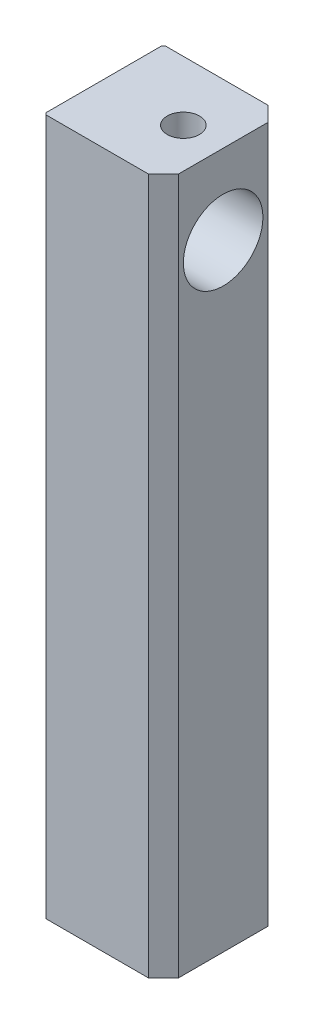
from build123d import *

# Parameters (mm, degrees)
SKETCH1_W           = 12
SKETCH1_H           = 12
BOSS_EXTRUDE1_DEPTH = 70
CHAMFER1_SIZE       = 0.2
CHAMFER2_SIZE       = 1.5
SKETCH2_R           = 4
CUT_EXTRUDE1_DEPTH  = 72.274118725
TAP1_REACH          = 73.274
TAP1_BORE_R         = 1.621


with BuildPart() as part:
    # Sketch1 → Boss-Extrude1 (new body)
    with BuildSketch(Plane(origin=(0, 0, 0), x_dir=(1, 0, 0), z_dir=(0, 1, 0))):
        with Locations((6, 0)):
            Rectangle(SKETCH1_W, SKETCH1_H)
    extrude(amount=BOSS_EXTRUDE1_DEPTH)

    # Chamfer1
    chamfer1_edges = [part.edges().sort_by_distance(p)[0] for p in [
        (0, 35, 6),
        (0, 35, -6),
    ]]
    chamfer(chamfer1_edges, length=CHAMFER1_SIZE)

    # Chamfer2
    chamfer2_edges = [part.edges().sort_by_distance(p)[0] for p in [
        (12, 35, -6),
        (12, 35, 6),
    ]]
    chamfer(chamfer2_edges, length=CHAMFER2_SIZE)

    # Sketch2 → Cut-Extrude1 (cut, through all)
    with BuildSketch(Plane(origin=(0, 0, 0), x_dir=(0, 0, -1), z_dir=(1, 0, 0))):
        with Locations(Location((0, 62, 0), (0, 0, 180))):
            Circle(SKETCH2_R)
    extrude(amount=CUT_EXTRUDE1_DEPTH, mode=Mode.SUBTRACT)

    # Tap1 bore → Tap1 (cut, up to next)
    with BuildSketch(Plane(origin=(0, 70, 0), x_dir=(1, 0, 0), z_dir=(0, 1, 0)), mode=Mode.PRIVATE) as tap1_sk1:
        with Locations((8, 0)):
            Circle(TAP1_BORE_R)
    tap1_tool1 = extrude(tap1_sk1.sketch, amount=-TAP1_REACH, mode=Mode.PRIVATE) & part.part
    add(tap1_tool1.solids().sort_by_distance((8, 70, 0))[0], mode=Mode.SUBTRACT)


solid = part.part
